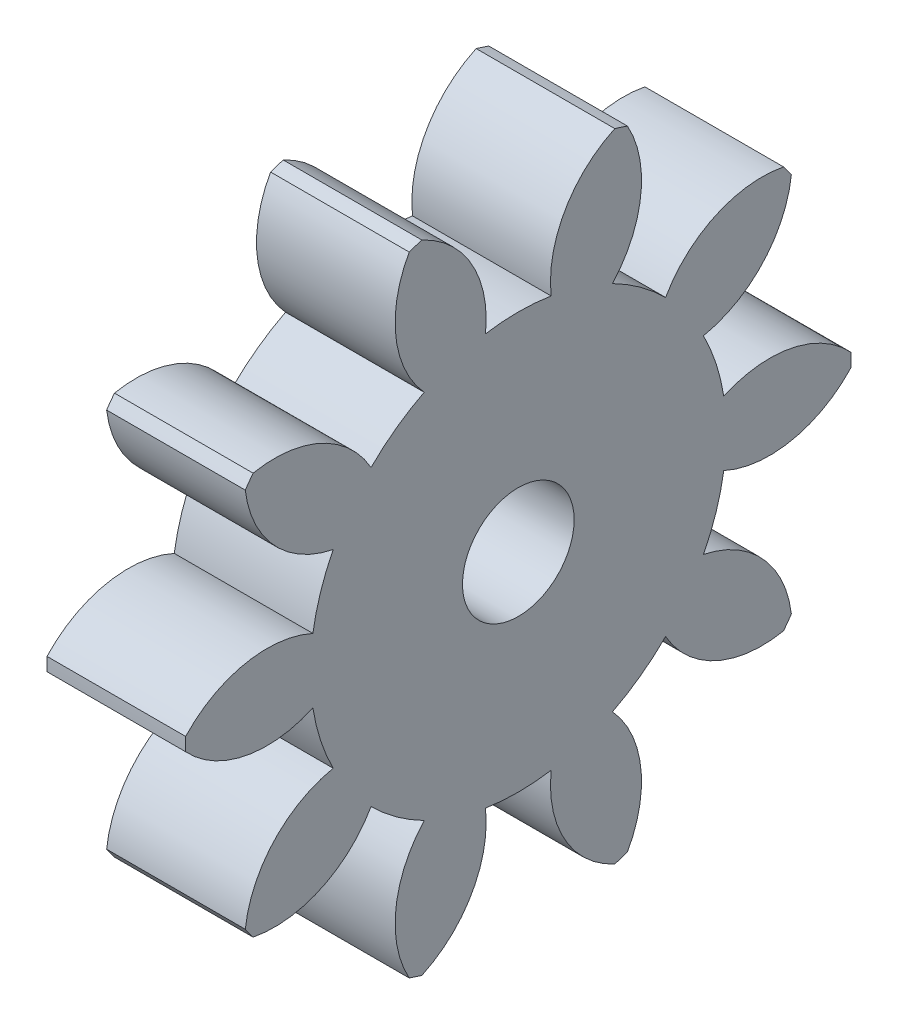
from build123d import *

# Parameters (mm, degrees)
BASPROSKE_W        = 12.7
BASPROSKE_H        = 30.48
TOOTHCUT_DEPTH     = 45.937187273
TEETHCUTS_COUNT    = 10
TEETHCUTS_ANGLE    = 324
BORSKE_R           = 0.396875
BORE_DEPTH         = 50.8000508
SKETCH1_R          = 5.113736545
CUT_EXTRUDE1_DEPTH = 45.059628491


with BuildPart() as part:
    # BasProSke → Base-Revolve (revolve)
    with BuildSketch(Plane(origin=(0, 0, 0), x_dir=(1, 0, 0), z_dir=(0, 1, 0)), mode=Mode.PRIVATE) as base_revolve_sk:
        with Locations((6.35, 15.24)):
            Rectangle(BASPROSKE_W, BASPROSKE_H)
    revolve(base_revolve_sk.sketch.rotate(Axis((-10, 0, 0), (1, 0, 0)), 180), axis=Axis((-10, 0, 0), (1, 0, 0)))

    # TooCutSke → ToothCut (cut, through all)
    with BuildSketch(Plane(origin=(0, 0, 0), x_dir=(0, 0, -1), z_dir=(1, 0, 0))):
        with BuildLine():
            ThreePointArc((3.007567521, 18.809802025), (0, 19.04873), (-3.007567521, 18.809802025))
            ThreePointArc((-3.007567521, 18.809802025), (-4.258277713, 24.948621571), (-8.872168133, 29.186710362))
            ThreePointArc((-8.872168133, 29.186710362), (0, 30.5054), (8.872168133, 29.186710362))
            ThreePointArc((8.872168133, 29.186710362), (4.258277713, 24.948621571), (3.007567521, 18.809802025))
        make_face()
    toothcut = extrude(amount=TOOTHCUT_DEPTH, mode=Mode.SUBTRACT)

    # TeethCuts: ToothCut ×10 about axis
    teethcuts_axis = Axis((-10, 0, 0), (1, 0, 0))
    for i in range(1, TEETHCUTS_COUNT):
        add(toothcut.rotate(teethcuts_axis, i * TEETHCUTS_ANGLE / (TEETHCUTS_COUNT - 1)), mode=Mode.SUBTRACT)

    # BorSke → Bore (cut, symmetric)
    with BuildSketch(Plane(origin=(0, 0, 0), x_dir=(0, 0, -1), z_dir=(1, 0, 0))):
        with Locations(Location((0, 0, 0), (0, 0, 180))):
            Circle(BORSKE_R)
    extrude(amount=BORE_DEPTH, both=True, mode=Mode.SUBTRACT)

    # Sketch1 → Cut-Extrude1 (cut, through all)
    with BuildSketch(Plane(origin=(12.7, 0, 0), x_dir=(0, 0, -1), z_dir=(1, 0, 0))):
        Circle(SKETCH1_R)
    extrude(amount=-CUT_EXTRUDE1_DEPTH, mode=Mode.SUBTRACT)


solid = part.part
